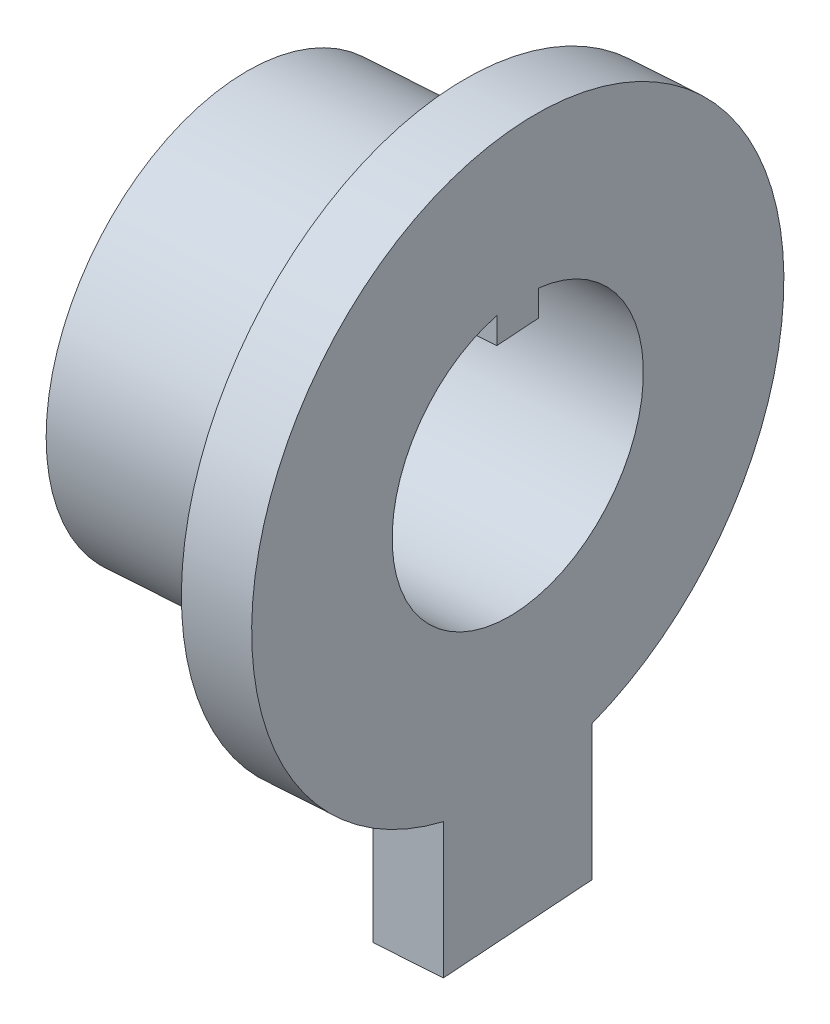
from build123d import *

# Parameters (mm, degrees)
ESQUISSE2_R             = 10.125
BOSS_EXTRU_1_DEPTH      = 10
ENL_V_MAT_EXTRU_1_DEPTH = 218.649228582
BOSS_EXTRU_2_START      = -3.3
BOSS_EXTRU_2_DEPTH      = 3.3


with BuildPart() as part:
    # Esquisse1 → Révolution1 (revolve)
    with BuildSketch(Plane(origin=(0, 72.395438751, 0), x_dir=(-1, 0, 0), z_dir=(0, 1, 0))):
        Polygon((91.397628985, 206.017597396), (92.357726425, 191.749864118), (95.650280259, 191.971425065), (94.690182819, 206.239158344), align=None)
    revolve(axis=Axis((-92.670542197, 72.395438751, 191.770913966), (-0.9977435859079083, 0, 0.06713968111056465)))

    # Esquisse2 → Boss.-Extru.1 (add)
    with BuildSketch(Plane(origin=(-108.078931537, 0, 7.272795436), x_dir=(0.06713968111057397, 0, 0.9977435859079078), z_dir=(-0.9977435859079079, 0, 0.06713968111057397))):
        with Locations((185.116328722, 72.395438751)):
            Circle(ESQUISSE2_R)
    extrude(amount=BOSS_EXTRU_1_DEPTH)

    # Esquisse3 → Enlèv. mat.-Extru.1 (cut, through all)
    with BuildSketch(Plane(origin=(-104.786377704, 0, 7.051234489), x_dir=(-0.06713968111057397, 0, -0.9977435859079078), z_dir=(0.9977435859079079, 0, -0.06713968111057397))):
        with BuildLine():
            Line((-186.241328722, 77.751028507), (-186.241328722, 79.051028507))
            ThreePointArc((-186.241328722, 79.051028507), (-185.116328722, 65.645438751), (-183.991328722, 79.051028507))
            Line((-183.991328722, 79.051028507), (-183.991328722, 77.751028507))
            Line((-183.991328722, 77.751028507), (-186.241328722, 77.751028507))
        make_face()
    extrude(amount=-ENL_V_MAT_EXTRU_1_DEPTH, mode=Mode.SUBTRACT)

    # Esquisse8 → Boss.-Extru.2 (add)
    with BuildSketch(Plane(origin=(-108.078931537, 0, 7.272795436), x_dir=(0.06713968111056465, 0, 0.9977435859079083), z_dir=(-0.9977435859079085, 0, 0.06713968111056466)).offset(BOSS_EXTRU_2_START)):
        with BuildLine():
            Line((181.116328722, 58.666272717), (181.116328722, 51.895438751))
            Line((181.116328722, 51.895438751), (189.116328722, 51.895438751))
            Line((189.116328722, 51.895438751), (189.116328722, 58.666272717))
            ThreePointArc((189.116328722, 58.666272717), (185.116328722, 58.095438751), (181.116328722, 58.666272717))
        make_face()
    extrude(amount=BOSS_EXTRU_2_DEPTH)


solid = part.part
